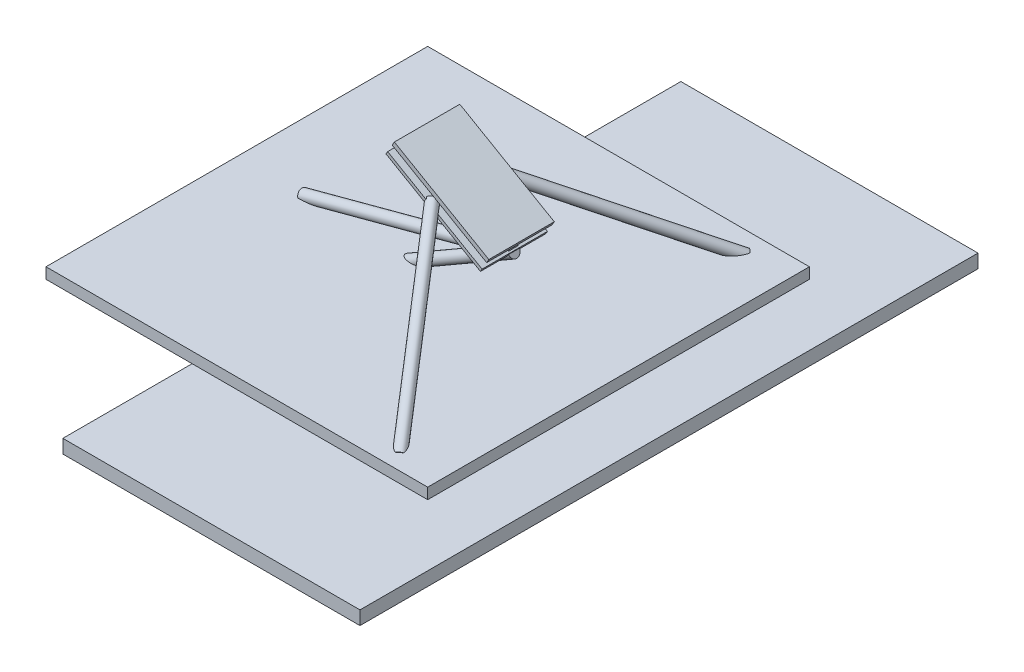
from build123d import *

# Parameters (mm, degrees)
SCHIZZO3_W                   = 200
SCHIZZO3_H                   = 120
ESTRUSIONE_ESTRUSIONE1_DEPTH = 3
SCHIZZO5_W                   = 700
SCHIZZO5_H                   = 700
ESTRUSIONE_ESTRUSIONE2_DEPTH = 20
SCHIZZO8_W                   = 379
SCHIZZO8_H                   = 10
SCHIZZO22_W                  = 544.918033461
SCHIZZO22_H                  = 1133.381514453
ESTRUSIONE_ESTRUSIONE3_DEPTH = 25
SCHIZZO24_W                  = 200
SCHIZZO24_H                  = 120
ESTRUSIONE_ESTRUSIONE4_DEPTH = 8


with BuildPart() as part:
    # Schizzo3 → Estrusione-Estrusione1 (new, symmetric)
    with BuildSketch(Plane(origin=(0, 0, 0), x_dir=(0.8660254037844421, -0.4999999999999939, 0), z_dir=(0.499999999999994, 0.8660254037844423, 0))):
        with Locations((-50, 0)):
            Rectangle(SCHIZZO3_W, SCHIZZO3_H)
    extrude(amount=ESTRUSIONE_ESTRUSIONE1_DEPTH, both=True)

    # Schizzo8 → Rivoluzione5 (revolve)
    with BuildSketch(Plane(origin=(4.874204469, -17.031133335, -14.506007809), x_dir=(-0.5495251793179629, 0.4449967160503128, -0.7071067811865462), z_dir=(-0.6293203910498404, -0.7771459614569687, 0)), mode=Mode.PRIVATE) as rivoluzione5_sk:
        with Locations((-179.459266043, -96.266005055)):
            Rectangle(SCHIZZO8_W, SCHIZZO8_H)
    rivoluzione5 = revolve(rivoluzione5_sk.sketch.rotate(Axis((-56.291651246, 32.5, 50), (0.5495251793179627, -0.44499671605031277, 0.7071067811865462)), 209.795615497), axis=Axis((-56.291651246, 32.5, 50), (0.5495251793179627, -0.44499671605031277, 0.7071067811865462)))

    # Specchia1: Rivoluzione5 across plane
    add(rivoluzione5.mirror(Plane.XY))

    # Schizzo17 → Rivoluzione4 (revolve)
    with BuildSketch(Plane.XY, mode=Mode.PRIVATE) as rivoluzione4_sk:
        Polygon((43.301270189, -25), (-248.549290886, -193.5), (-243.549290886, -202.160254038), (48.301270189, -33.660254038), align=None)
    revolve(rivoluzione4_sk.sketch.rotate(Axis((43.301270189, -25, 0), (-0.8660254037844356, -0.5000000000000054, 0)), 180), axis=Axis((43.301270189, -25, 0), (-0.8660254037844356, -0.5000000000000054, 0)))


with BuildPart() as body_2:
    # Schizzo5 → Estrusione-Estrusione2 (new body)
    with BuildSketch(Plane(origin=(0, -128.527618041, 0), x_dir=(-1, 0, 0), z_dir=(0, -1, 0))):
        with Locations((114.931214363, 0)):
            Rectangle(SCHIZZO5_W, SCHIZZO5_H)
    extrude(amount=ESTRUSIONE_ESTRUSIONE2_DEPTH)


with BuildPart() as body_3:
    # Schizzo1 → Rivoluzione1 (revolve)
    with BuildSketch(Plane.XY, mode=Mode.PRIVATE) as rivoluzione1_sk:
        Polygon((43.301270189, -25), (-343.069060326, -128.527618041), (-340.480869875, -138.186876304), (45.88946064, -34.659258263), align=None)
    revolve(rivoluzione1_sk.sketch.rotate(Axis((43.301270189, -25, 0), (-0.9659258262890681, -0.2588190451025217, 0)), 180), axis=Axis((43.301270189, -25, 0), (-0.9659258262890681, -0.2588190451025217, 0)))


with BuildPart() as body_4:
    # Schizzo22 → Estrusione-Estrusione3 (new body)
    with BuildSketch(Plane(origin=(0, -204.5, 0), x_dir=(-1, 0, 0), z_dir=(0, -1, 0))):
        with Locations((-19.498183113, 35.619737897)):
            Rectangle(SCHIZZO22_W, SCHIZZO22_H)
    extrude(amount=ESTRUSIONE_ESTRUSIONE3_DEPTH)


with BuildPart() as body_5:
    # Schizzo24 → Estrusione-Estrusione4 (new body)
    with BuildSketch(Plane(origin=(9.876883406, 17.10726388, 0), x_dir=(0.8660254037844421, -0.4999999999999939, 0), z_dir=(0.4999999999999939, 0.8660254037844421, 0))):
        with Locations((-50, 0)):
            Rectangle(SCHIZZO24_W, SCHIZZO24_H)
    extrude(amount=ESTRUSIONE_ESTRUSIONE4_DEPTH)


solid = Compound([part.part, body_2.part, body_3.part, body_4.part, body_5.part])
